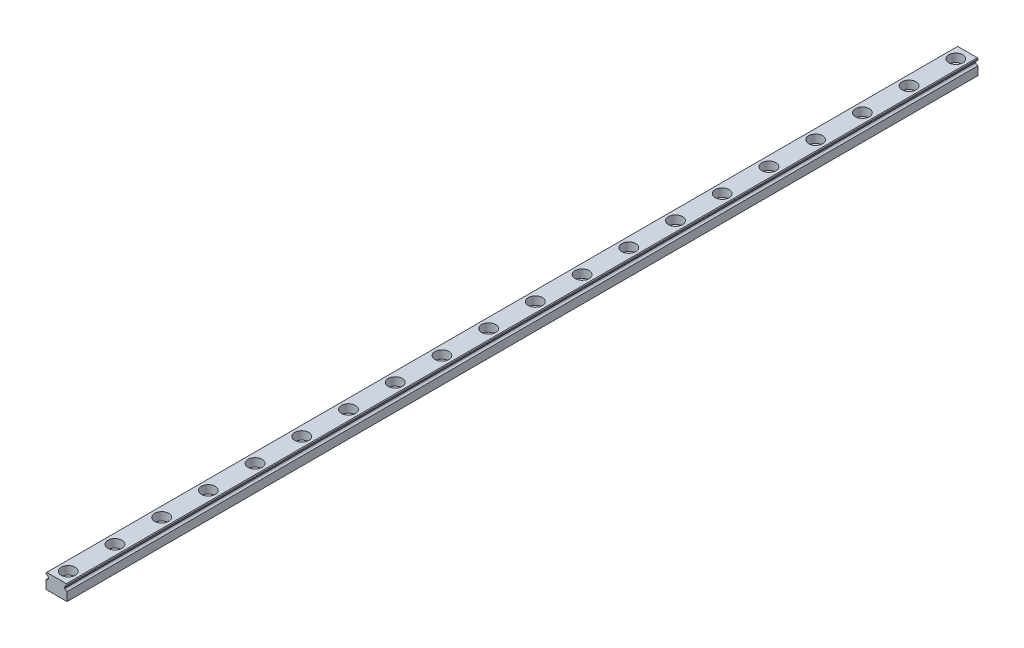
from build123d import *

# Parameters (mm, degrees)
EXTRUDE1_DEPTH  = 390
SKETCH2_R       = 3
EXTRUDE2_DEPTH  = 3.5
SKETCH_R        = 1.75
EXTRUDE3_DEPTH  = 391.080119975
LPATTERN1_COUNT = 40
LPATTERN1_PITCH = 20
CHAMFER1_SIZE   = 0.3


with BuildPart() as part:
    # Sketch1 → Extrude1 (new body)
    with BuildSketch(Plane.XY):
        with BuildLine():
            Line((-4.5, -3.25), (4.5, -3.25))
            Line((4.5, -3.25), (4.5, 0.45))
            ThreePointArc((4.5, 0.45), (3.887627564, 0.659430585), (3.531754163, 1.2))
            Line((3.531754163, 1.2), (3.4, 1.2))
            Line((3.4, 1.2), (3.4, 1.7))
            Line((3.4, 1.7), (3.531754163, 1.7))
            ThreePointArc((3.531754163, 1.7), (3.887627564, 2.240569415), (4.5, 2.45))
            Line((4.5, 2.45), (4.5, 3.25))
            Line((4.5, 3.25), (-4.5, 3.25))
            Line((-4.5, 3.25), (-4.5, 2.45))
            ThreePointArc((-4.5, 2.45), (-3.887627564, 2.240569415), (-3.531754163, 1.7))
            Line((-3.531754163, 1.7), (-3.4, 1.7))
            Line((-3.4, 1.7), (-3.4, 1.2))
            Line((-3.4, 1.2), (-3.531754163, 1.2))
            ThreePointArc((-3.531754163, 1.2), (-3.887627564, 0.659430585), (-4.5, 0.45))
            Line((-4.5, 0.45), (-4.5, -3.25))
        make_face()
    extrude(amount=EXTRUDE1_DEPTH)

    # Sketch2 → Extrude2 (cut)
    with BuildSketch(Plane(origin=(0, 3.25, 0), x_dir=(1, 0, 0), z_dir=(0, 1, 0))):
        with Locations((0, -5)):
            Circle(SKETCH2_R)
    extrude2 = extrude(amount=-EXTRUDE2_DEPTH, mode=Mode.SUBTRACT)

    # Sketch → Extrude3 (cut, through all)
    with BuildSketch(Plane(origin=(0, 3.25, 0), x_dir=(1, 0, 0), z_dir=(0, 1, 0))):
        with Locations((0, -5)):
            Circle(SKETCH_R)
    extrude3 = extrude(amount=-EXTRUDE3_DEPTH, mode=Mode.SUBTRACT)

    # LPattern1: Extrude2, Extrude3 ×40
    with Locations(*[(0, 0, i * LPATTERN1_PITCH) for i in range(1, LPATTERN1_COUNT)]):
        add(extrude2, mode=Mode.SUBTRACT)
        add(extrude3, mode=Mode.SUBTRACT)

    # Chamfer1
    chamfer1_edges = [part.edges().sort_by_distance(p)[0] for p in [
        (4.5, 3.25, 195),
        (-4.5, 3.25, 195),
    ]]
    chamfer(chamfer1_edges, length=CHAMFER1_SIZE)


solid = part.part
